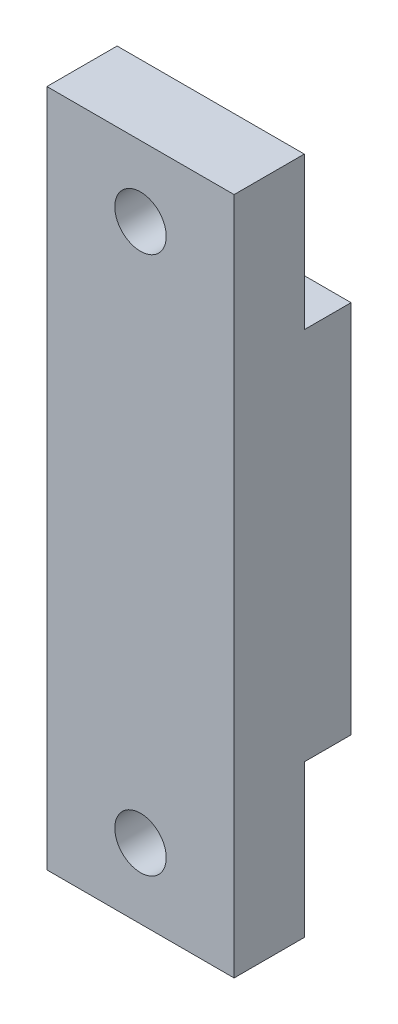
from build123d import *

# Parameters (mm, degrees)
SKETCH_1_W            = 8
SKETCH_1_H            = 29
EXTRUDE_241_DEPTH     = 3
SKETCH_2_W            = 8
SKETCH_2_H            = 16
EXTRUDE_361_DEPTH     = 2
CUT_EXTRUDE_555_REACH = 17.851
SKETCH_3_R            = 1.1


with BuildPart() as part:
    # 草图1 → Extrude 241 (new body)
    with BuildSketch(Plane.XY):
        Rectangle(SKETCH_1_W, SKETCH_1_H)
    extrude(amount=EXTRUDE_241_DEPTH)

    # 草图2 → Extrude 361 (add)
    with BuildSketch(Plane.XY):
        Rectangle(SKETCH_2_W, SKETCH_2_H)
    extrude(amount=-EXTRUDE_361_DEPTH)

    # 草图3 → Cut-Extrude 555 (cut, up to next)
    with BuildSketch(Plane.XY.offset(3), mode=Mode.PRIVATE) as cut_extrude_555_sk1:
        with Locations((0, 11.5)):
            Circle(SKETCH_3_R)
    cut_extrude_555_tool1 = extrude(cut_extrude_555_sk1.sketch, amount=-CUT_EXTRUDE_555_REACH, mode=Mode.PRIVATE) & part.part
    # 草图3 → Cut-Extrude 555 (cut, up to next)
    with BuildSketch(Plane.XY.offset(3), mode=Mode.PRIVATE) as cut_extrude_555_sk2:
        with Locations((0, -11.5)):
            Circle(SKETCH_3_R)
    cut_extrude_555_tool2 = extrude(cut_extrude_555_sk2.sketch, amount=-CUT_EXTRUDE_555_REACH, mode=Mode.PRIVATE) & part.part
    add(cut_extrude_555_tool1.solids().sort_by_distance((0, 11.5, 3))[0], mode=Mode.SUBTRACT)
    add(cut_extrude_555_tool2.solids().sort_by_distance((0, -11.5, 3))[0], mode=Mode.SUBTRACT)


solid = part.part
